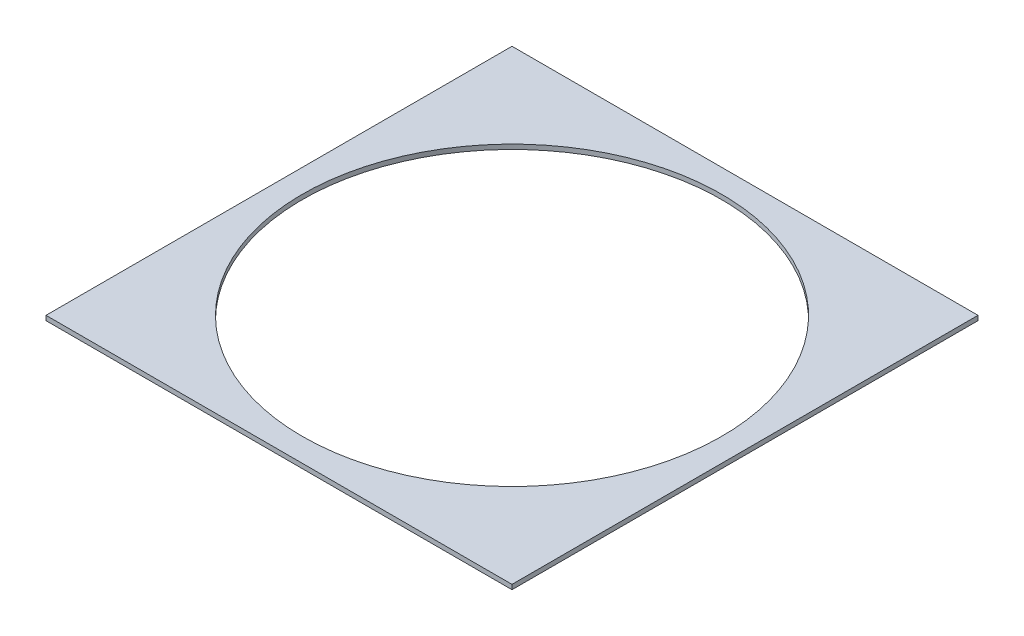
from build123d import *

# Parameters (mm, degrees)
SKETCH1_W           = 127
SKETCH1_H           = 127
BOSS_EXTRUDE1_DEPTH = 1.27
SKETCH2_R           = 57.15
CUT_EXTRUDE1_DEPTH  = 1.27


with BuildPart() as part:
    # Sketch1 → Boss-Extrude1 (new body)
    with BuildSketch(Plane(origin=(0, 0, 0), x_dir=(1, 0, 0), z_dir=(0, 1, 0))):
        Rectangle(SKETCH1_W, SKETCH1_H)
    extrude(amount=BOSS_EXTRUDE1_DEPTH)

    # Sketch2 → Cut-Extrude1 (cut)
    with BuildSketch(Plane(origin=(0, 1.27, 0), x_dir=(-1, 0, 0), z_dir=(0, 1, 0))):
        with Locations(Location((0, 0, 0), (0, 0, 90))):
            Circle(SKETCH2_R)
    extrude(amount=-CUT_EXTRUDE1_DEPTH, mode=Mode.SUBTRACT)


solid = part.part
